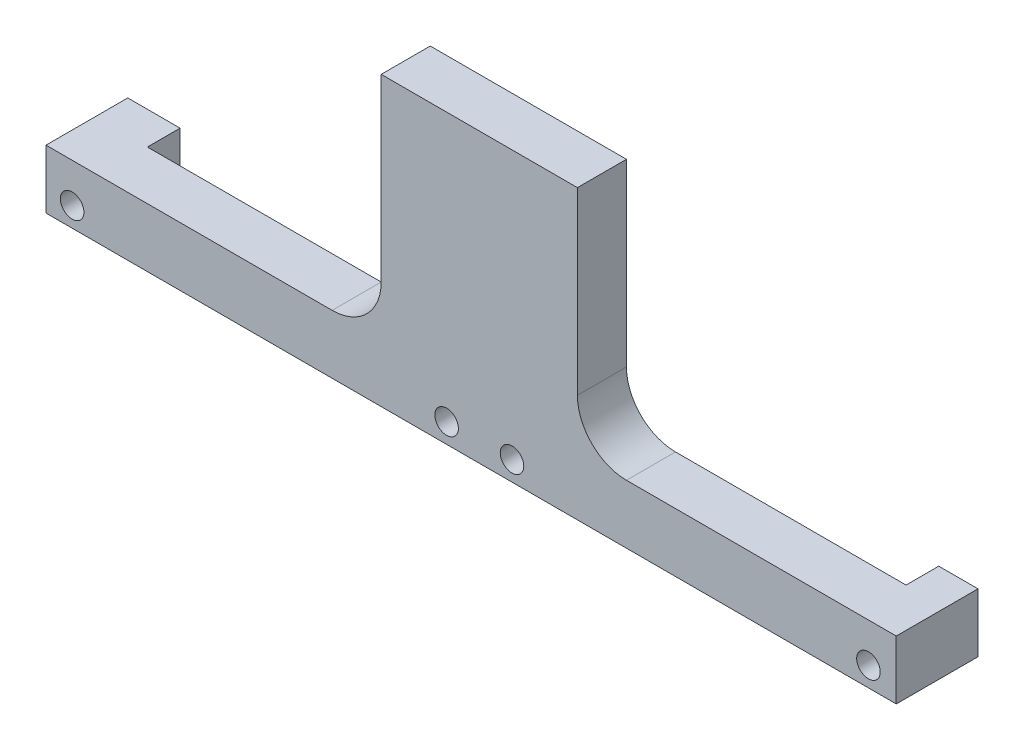
from build123d import *
from build123d.topology import SkipClean

# Parameters (mm, degrees)
SKETCH1_R               = 1.8
MOUNTING_FACE_DEPTH     = 7.5
CELL_SUPPORT_FILLETS_R  = 7.5
MIDLINE_START           = 5
SKETCH3_W               = 20
SKETCH3_H               = 6
SKETCH3_R               = 1.8
SKETCH3_W_2             = 8
SKETCH3_H_2             = 9
MIDLINE_EXTENSION_DEPTH = 5


with BuildPart() as part:
    # Sketch1 → Mounting Face (new body)
    with BuildSketch(Plane.XY):
        Polygon((130, 0), (130, 9), (81.25, 9), (81.25, 44), (51.25, 44), (51.25, 9), (0, 9), (0, 0), align=None)
        with Locations((4, 3)):
            Circle(SKETCH1_R, mode=Mode.SUBTRACT)
        with Locations((61.25, 3)):
            Circle(SKETCH1_R, mode=Mode.SUBTRACT)
        with Locations((71.25, 3)):
            Circle(SKETCH1_R, mode=Mode.SUBTRACT)
        with Locations((125.75, 3)):
            Circle(SKETCH1_R, mode=Mode.SUBTRACT)
    extrude(amount=MOUNTING_FACE_DEPTH)

    # Cell Support Fillets
    cell_support_fillets_edges = [part.edges().sort_by_distance(p)[0] for p in [
        (81.25, 9, 3.75),
        (51.25, 9, 3.75),
    ]]
    fillet(cell_support_fillets_edges, radius=CELL_SUPPORT_FILLETS_R)

    # Sketch3 → Midline Extension (add)
    # profile 1 of 3: a face of its own
    with SkipClean():  # the faces are left unmerged after this step: merging them gives an invalid solid
        with BuildSketch(Plane(origin=(0, 0, 0), x_dir=(-1, 0, 0), z_dir=(0, 0, -1)).offset(MIDLINE_START)):
            with Locations((-66.25, 3)):
                Rectangle(SKETCH3_W, SKETCH3_H)
            with Locations((-71.25, 3)):
                Circle(SKETCH3_R, mode=Mode.SUBTRACT)
            with Locations((-61.25, 3)):
                Circle(SKETCH3_R, mode=Mode.SUBTRACT)
        # profile 2 of 3: a face of its own
        with BuildSketch(Plane(origin=(0, 0, 0), x_dir=(-1, 0, 0), z_dir=(0, 0, -1)).offset(MIDLINE_START)):
            with Locations((-4, 4.5)):
                Rectangle(SKETCH3_W_2, SKETCH3_H_2)
            with Locations((-4, 3)):
                Circle(SKETCH3_R, mode=Mode.SUBTRACT)
        # profile 3 of 3: a face of its own
        with BuildSketch(Plane(origin=(0, 0, 0), x_dir=(-1, 0, 0), z_dir=(0, 0, -1)).offset(MIDLINE_START)):
            with BuildLine():
                Line((-130, 0), (-124, 0))
                Line((-124, 0), (-124, 2.578692511))
                ThreePointArc((-124, 2.578692511), (-127.55, 3), (-124, 3.421307489))
                Line((-124, 3.421307489), (-124, 9))
                Line((-124, 9), (-130, 9))
                Line((-130, 9), (-130, 0))
            make_face()
        extrude(amount=-MIDLINE_EXTENSION_DEPTH)


solid = part.part
